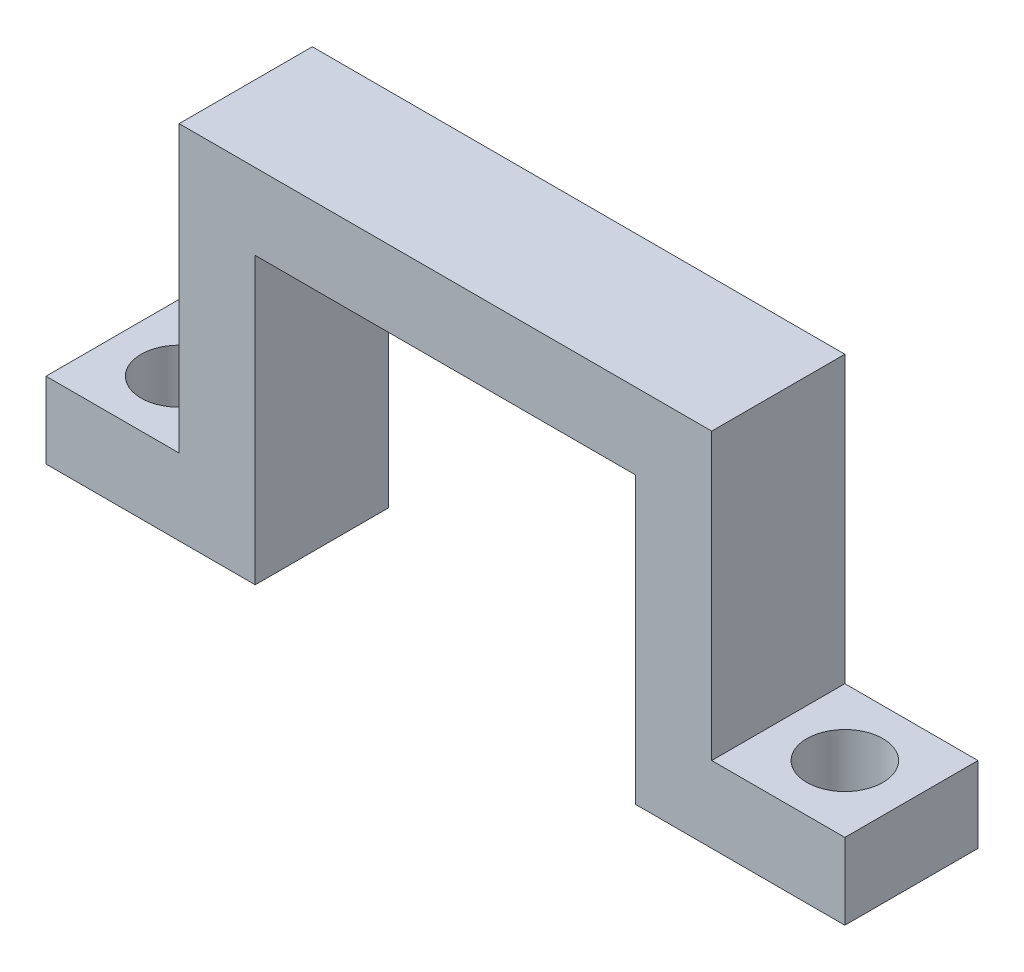
from build123d import *

# Parameters (mm, degrees)
EXTRUDE_1_DEPTH     = 7
SKETCH_2_R          = 2
CUT_EXTRUDE_1_DEPTH = 34.066457703


with BuildPart() as part:
    # 草图1 → 凸台-拉伸1 (new body)
    with BuildSketch(Plane.XY):
        Polygon((-2.375, -4), (-2.375, 11), (17.625, 11), (17.625, -4), (28.625, -4), (28.625, 0), (21.625, 0), (21.625, 15), (-6.375, 15), (-6.375, 0), (-13.375, 0), (-13.375, -4), align=None)
    extrude(amount=EXTRUDE_1_DEPTH)

    # 草图2 → 切除-拉伸1 (cut, through all)
    with BuildSketch(Plane(origin=(0, 0, 0), x_dir=(1, 0, 0), z_dir=(0, 1, 0))):
        with Locations(Location((25.125, -3.5, 0), (0, 0, 180))):
            Circle(SKETCH_2_R)
        with Locations((-9.875, -3.5)):
            Circle(SKETCH_2_R)
    extrude(amount=-CUT_EXTRUDE_1_DEPTH, mode=Mode.SUBTRACT)


solid = part.part
